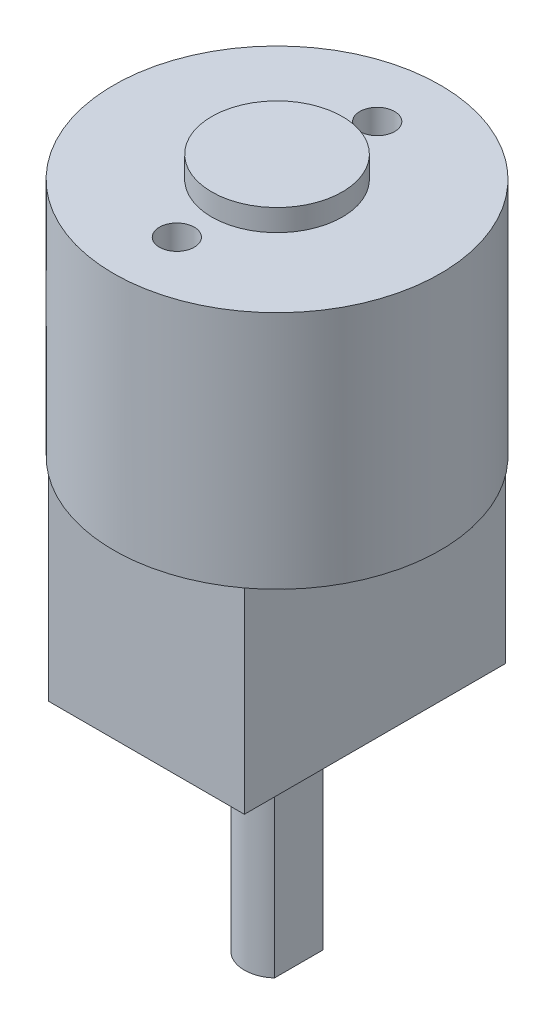
from build123d import *

# Parameters (mm, degrees)
SKETCH1_R           = 7.5
BOSS_EXTRUDE1_DEPTH = 11
SKETCH2_R           = 3
BOSS_EXTRUDE2_DEPTH = 1
SKETCH3_W           = 9
SKETCH3_H           = 12
BOSS_EXTRUDE3_DEPTH = 9
SKETCH4_R           = 2
BOSS_EXTRUDE4_DEPTH = 0.7
SKETCH5_R           = 1.5
BOSS_EXTRUDE5_DEPTH = 10
CUT_EXTRUDE1_DEPTH  = 10
SKETCH7_R           = 0.8
CUT_EXTRUDE2_DEPTH  = 5
SKETCH8_R           = 0.8
CUT_EXTRUDE3_DEPTH  = 5


with BuildPart() as part:
    # Sketch1 → Boss-Extrude1 (new body)
    with BuildSketch(Plane(origin=(0, 0, 0), x_dir=(1, 0, 0), z_dir=(0, 1, 0))):
        with Locations(Location((0, 0, 0), (0, 0, 270))):
            Circle(SKETCH1_R)
    extrude(amount=BOSS_EXTRUDE1_DEPTH)

    # Sketch2 → Boss-Extrude2 (add)
    with BuildSketch(Plane(origin=(0, 11, 0), x_dir=(1, 0, 0), z_dir=(0, 1, 0))):
        with Locations(Location((0, 0, 0), (0, 0, 270))):
            Circle(SKETCH2_R)
    extrude(amount=BOSS_EXTRUDE2_DEPTH)

    # Sketch3 → Boss-Extrude3 (add)
    with BuildSketch(Plane.XZ):
        Rectangle(SKETCH3_W, SKETCH3_H)
    extrude(amount=BOSS_EXTRUDE3_DEPTH)

    # Sketch4 → Boss-Extrude4 (add)
    with BuildSketch(Plane.XZ.offset(9)):
        with Locations(Location((0, 0, 0), (0, 0, 270))):
            Circle(SKETCH4_R)
    extrude(amount=BOSS_EXTRUDE4_DEPTH)

    # Sketch5 → Boss-Extrude5 (add)
    with BuildSketch(Plane.XZ.offset(9.7)):
        with Locations(Location((0, 0, 0), (0, 0, 270))):
            Circle(SKETCH5_R)
    extrude(amount=BOSS_EXTRUDE5_DEPTH)

    # Sketch6 → Cut-Extrude1 (cut)
    with BuildSketch(Plane.XZ.offset(19.7)):
        Polygon((1, 35.32716531), (1, 1.118033989), (1, -1.118033989), (1, -35.32716531), (69.418262642, -35.32716531), (69.418262642, 35.32716531), align=None)
    extrude(amount=-CUT_EXTRUDE1_DEPTH, mode=Mode.SUBTRACT)

    # Sketch7 → Cut-Extrude2 (cut)
    with BuildSketch(Plane.XZ.offset(9)):
        with Locations(Location((0, 4.5, 0), (0, 0, 270))):
            Circle(SKETCH7_R)
        with Locations(Location((0, -4.5, 0), (0, 0, 270))):
            Circle(SKETCH7_R)
    extrude(amount=-CUT_EXTRUDE2_DEPTH, mode=Mode.SUBTRACT)

    # Sketch8 → Cut-Extrude3 (cut)
    with BuildSketch(Plane(origin=(0, 11, 0), x_dir=(1, 0, 0), z_dir=(0, 1, 0))):
        with Locations(Location((0, 4.6, 0), (0, 0, 270))):
            Circle(SKETCH8_R)
        with Locations(Location((0, -4.6, 0), (0, 0, 270))):
            Circle(SKETCH8_R)
    extrude(amount=-CUT_EXTRUDE3_DEPTH, mode=Mode.SUBTRACT)


solid = part.part
